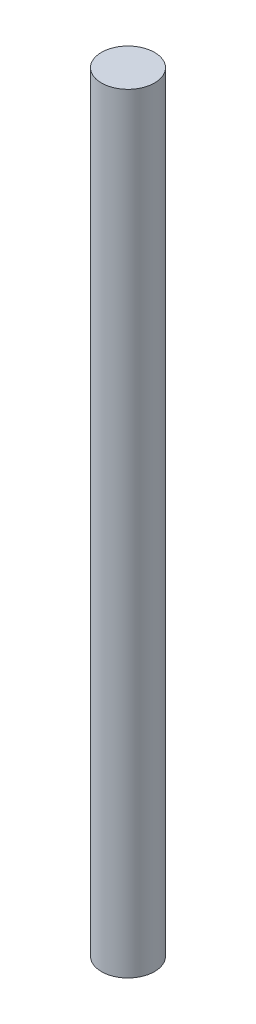
from build123d import *

# Parameters (mm, degrees)
SKETCH1_R           = 5
BOSS_EXTRUDE1_DEPTH = 145


with BuildPart() as part:
    # Sketch1 → Boss-Extrude1 (new body)
    with BuildSketch(Plane(origin=(0, 0, 0), x_dir=(1, 0, 0), z_dir=(0, 1, 0))):
        with Locations(Location((0, 0, 0), (0, 0, 270))):
            Circle(SKETCH1_R)
    extrude(amount=BOSS_EXTRUDE1_DEPTH)


solid = part.part
